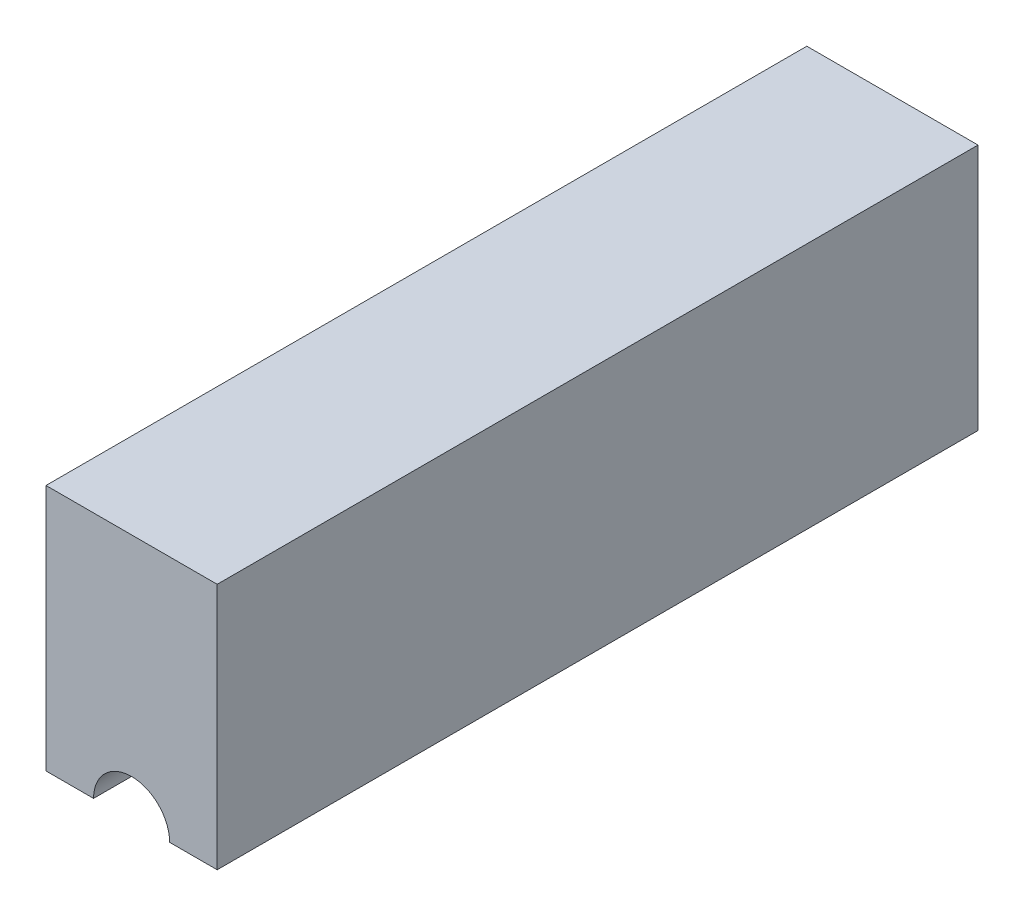
from build123d import *

# Parameters (mm, degrees)
BASE_EXTRUDE_DEPTH = 100


with BuildPart() as part:
    # Sketch1 → Base-Extrude (new, symmetric)
    with BuildSketch(Plane.XY):
        with BuildLine():
            Line((32.5, 0), (45, 0))
            Line((45, 0), (45, 65))
            Line((45, 65), (0, 65))
            Line((0, 65), (0, 0))
            Line((0, 0), (12.5, 0))
            ThreePointArc((12.5, 0), (22.5, 10), (32.5, 0))
        make_face()
    extrude(amount=BASE_EXTRUDE_DEPTH, both=True)


solid = part.part
